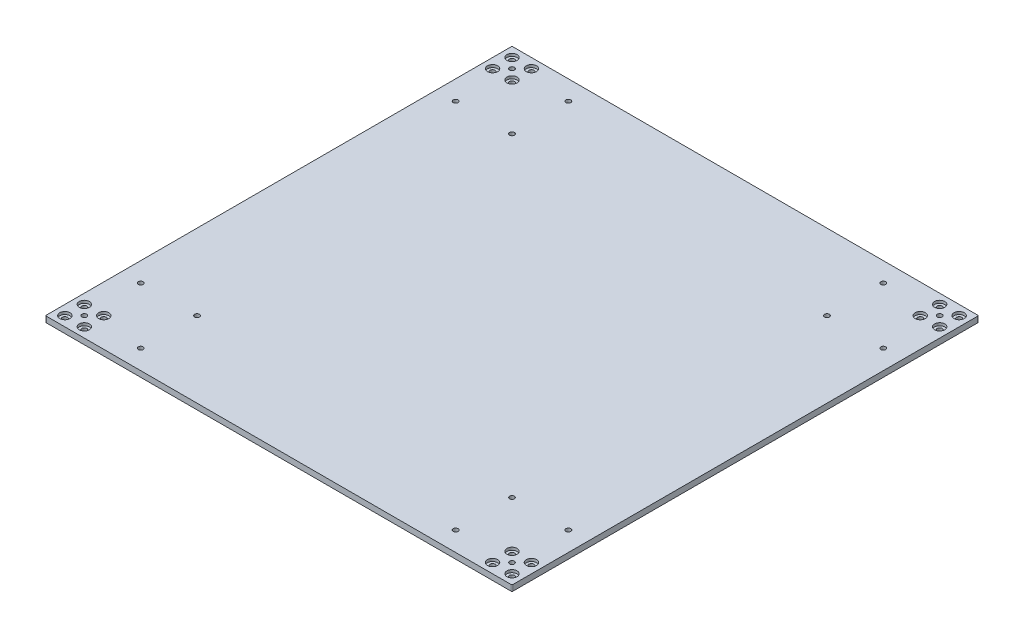
from build123d import *

# Parameters (mm, degrees)
SKETCH1_W                       = 480
SKETCH1_H                       = 480
BOSS_EXTRUDE1_DEPTH             = 6
CBORE_FOR_M5_SBHCS1_D           = 5.3
CBORE_FOR_M5_SBHCS1_CBORE_D     = 10.5
CBORE_FOR_M5_SBHCS1_CBORE_DEPTH = 2.75
TAP_DRILL_FOR_M6X1_0_TAP1_D     = 5
CIRPATTERN1_COUNT               = 4
FILLET1_R                       = 1


with BuildPart() as part:
    # Sketch1 → Boss-Extrude1 (new body)
    with BuildSketch(Plane(origin=(0, 0, 0), x_dir=(1, 0, 0), z_dir=(0, 1, 0))):
        Rectangle(SKETCH1_W, SKETCH1_H)
    extrude(amount=BOSS_EXTRUDE1_DEPTH)

    # CBORE for M5 SBHCS1 (through all)
    with Locations(Plane(origin=(0, 6, 0), x_dir=(1, 0, 0), z_dir=(0, 1, 0))):
        with Locations((-230, 230), (-210, 230), (-210, 210), (-230, 210)):
            cbore_for_m5_sbhcs1 = CounterBoreHole(CBORE_FOR_M5_SBHCS1_D / 2, CBORE_FOR_M5_SBHCS1_CBORE_D / 2, CBORE_FOR_M5_SBHCS1_CBORE_DEPTH)

    # Tap Drill for M6x1.0 Tap1 (through all)
    with Locations(Plane(origin=(0, 6, 0), x_dir=(1, 0, 0), z_dir=(0, 1, 0))):
        with Locations((-220, 220), (-162, 220), (-162, 162), (-220, 162)):
            tap_drill_for_m6x1_0_tap1 = Hole(TAP_DRILL_FOR_M6X1_0_TAP1_D / 2)

    # CirPattern1: CBORE for M5 SBHCS1, Tap Drill for M6x1.0 Tap1 ×4 about axis
    cirpattern1_axis = Axis((0, 8.4, 0), (0, -1, 0))
    add([cbore_for_m5_sbhcs1.rotate(cirpattern1_axis, i * 360 / CIRPATTERN1_COUNT) for i in range(1, CIRPATTERN1_COUNT)], mode=Mode.SUBTRACT)
    add([tap_drill_for_m6x1_0_tap1.rotate(cirpattern1_axis, i * 360 / CIRPATTERN1_COUNT) for i in range(1, CIRPATTERN1_COUNT)], mode=Mode.SUBTRACT)

    # Fillet1
    fillet1_edges = [part.edges().sort_by_distance(p)[0] for p in [
        (-240, 3, -240),
        (240, 3, -240),
        (240, 3, 240),
        (-240, 3, 240),
    ]]
    fillet(fillet1_edges, radius=FILLET1_R)


solid = part.part
